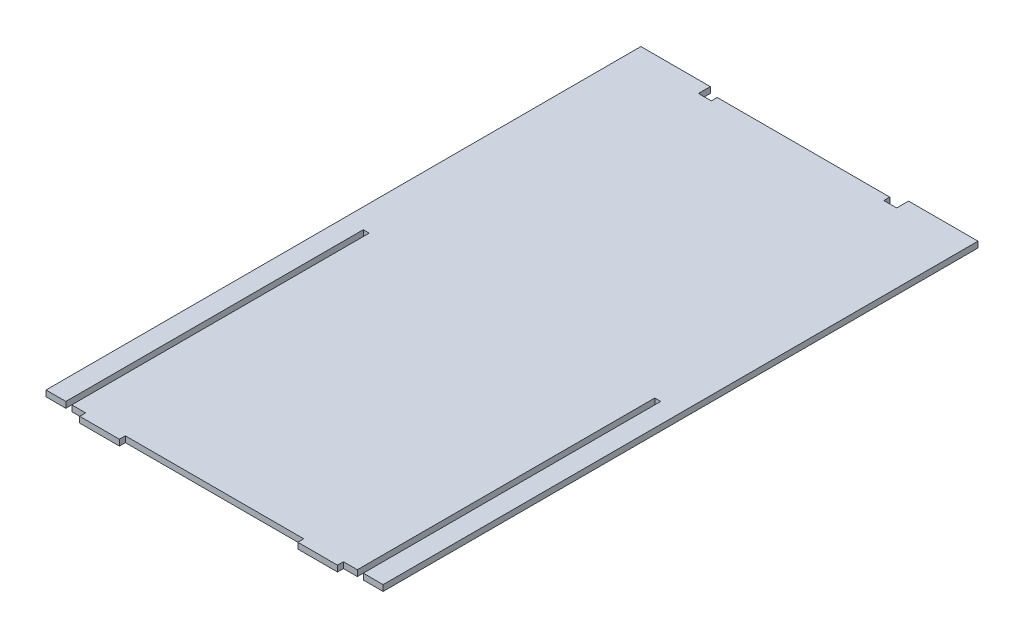
from build123d import *

# Parameters (mm, degrees)
BOSS_EXTRUDE1_DEPTH = 6
SKETCH2_W           = 6
SKETCH2_H           = 300
CUT_EXTRUDE1_DEPTH  = 6
LPATTERN1_COUNT     = 2
LPATTERN1_PITCH     = 294
CUT_EXTRUDE2_DEPTH  = 6


with BuildPart() as part:
    # Sketch1 → Boss-Extrude1 (new body)
    with BuildSketch(Plane(origin=(0, 0, 0), x_dir=(1, 0, 0), z_dir=(0, 1, 0))):
        Polygon((300, 0), (300, -6), (260, -6), (260, 0), (80, 0), (80, -6), (40, -6), (40, 0), (0, 0), (0, 600), (340, 600), (340, 0), align=None)
    extrude(amount=BOSS_EXTRUDE1_DEPTH)

    # Sketch2 → Cut-Extrude1 (cut)
    with BuildSketch(Plane(origin=(0, 6, 0), x_dir=(1, 0, 0), z_dir=(0, 1, 0))):
        with Locations((23, 150)):
            Rectangle(SKETCH2_W, SKETCH2_H)
    cut_extrude1 = extrude(amount=-CUT_EXTRUDE1_DEPTH, mode=Mode.SUBTRACT)

    # LPattern1: Cut-Extrude1 ×2
    with Locations(*[(i * LPATTERN1_PITCH, 0, 0) for i in range(1, LPATTERN1_COUNT)]):
        add(cut_extrude1, mode=Mode.SUBTRACT)

    # Sketch3 → Cut-Extrude2 (cut)
    with BuildSketch(Plane(origin=(0, 6, 0), x_dir=(1, 0, 0), z_dir=(0, 1, 0))):
        Polygon((70, 600), (270, 600), (270, 588), (257, 588), (257, 594), (83, 594), (83, 588), (70, 588), align=None)
    extrude(amount=-CUT_EXTRUDE2_DEPTH, mode=Mode.SUBTRACT)


solid = part.part
